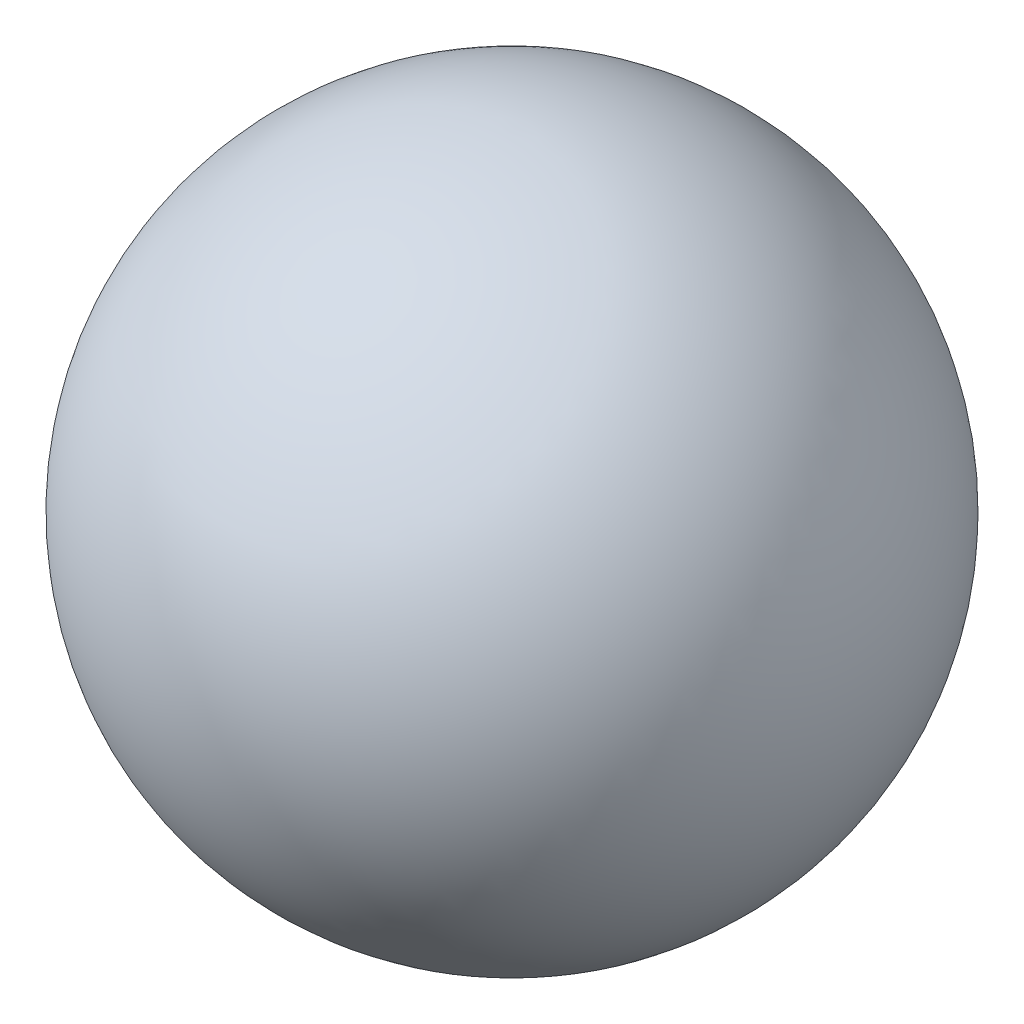
from build123d import *


with BuildPart() as part:
    # Sketch4 → Revolve1 (revolve)
    with BuildSketch(Plane(origin=(0, 0, 0), x_dir=(0, 0, -1), z_dir=(1, 0, 0))):
        with BuildLine():
            Line((-1.434299909, 51.064603712), (1.434299909, -51.064603712))
            ThreePointArc((1.434299909, -51.064603712), (51.064603712, 1.434299909), (-1.434299909, 51.064603712))
        make_face()
    revolve(axis=Axis((0, 51.064603712, 1.434299909), (0, -0.9996057668546634, -0.02807687430787825)))


solid = part.part
